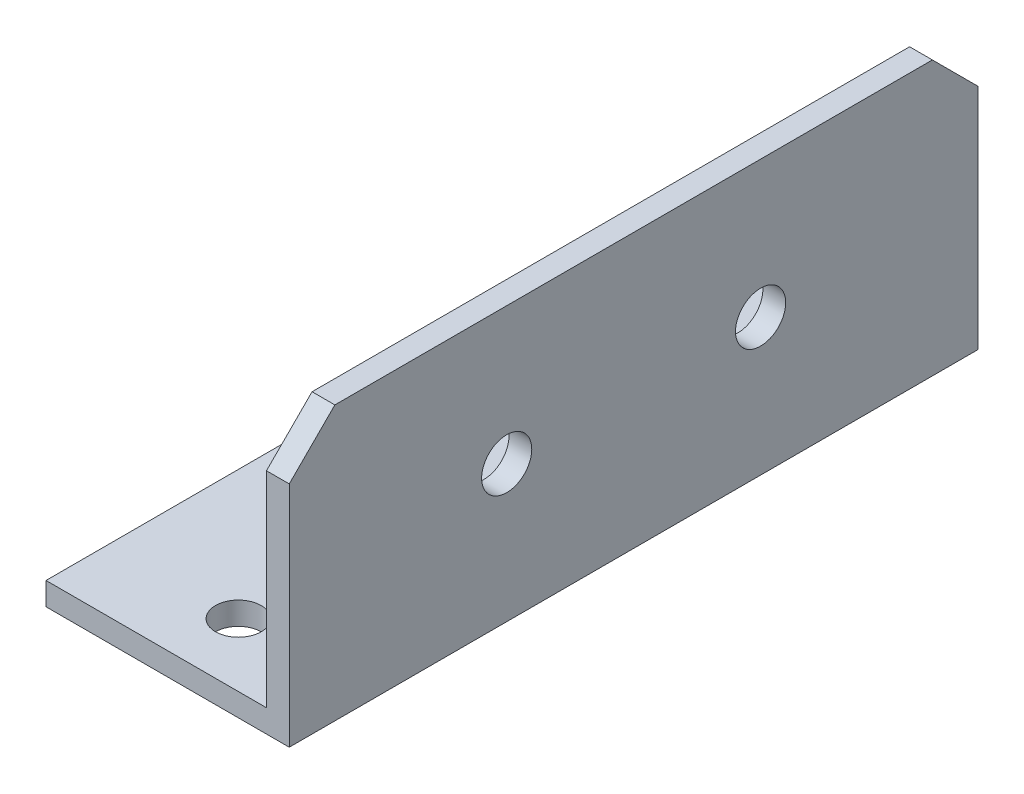
from build123d import *

# Parameters (mm, degrees)
BOSS_EXTRUDE1_DEPTH = 45.3
SKETCH2_R           = 1.65
CUT_EXTRUDE1_DEPTH  = 50.873239317
SKETCH3_R           = 1.5
CUT_EXTRUDE2_DEPTH  = 51.797047158


with BuildPart() as part:
    # Sketch1 → Boss-Extrude1 (new body)
    with BuildSketch(Plane.XY):
        Polygon((0, 0), (0, 18), (-1.5, 18), (-1.5, 1.5), (-16, 1.5), (-16, 0), align=None)
    extrude(amount=BOSS_EXTRUDE1_DEPTH)

    # Sketch2 → Cut-Extrude1 (cut, through all)
    with BuildSketch(Plane(origin=(-1.5, 3, 0), x_dir=(0, 1, 0), z_dir=(-1, 0, 0))):
        Polygon((12, 0), (15, -3), (15, 0), align=None)
        Polygon((15, -42.3), (12, -45.3), (15, -45.3), align=None)
        with Locations((6, -31)):
            Circle(SKETCH2_R)
        with Locations((6, -14.3)):
            Circle(SKETCH2_R)
    extrude(amount=-CUT_EXTRUDE1_DEPTH, mode=Mode.SUBTRACT)

    # Sketch3 → Cut-Extrude2 (cut, through all)
    with BuildSketch(Plane(origin=(0, 1.5, 0), x_dir=(1, 0, 0), z_dir=(0, 1, 0))):
        with Locations((-7.5, -4.15)):
            Circle(SKETCH3_R)
        with Locations((-7.5, -41.15)):
            Circle(SKETCH3_R)
    extrude(amount=-CUT_EXTRUDE2_DEPTH, mode=Mode.SUBTRACT)


solid = part.part
